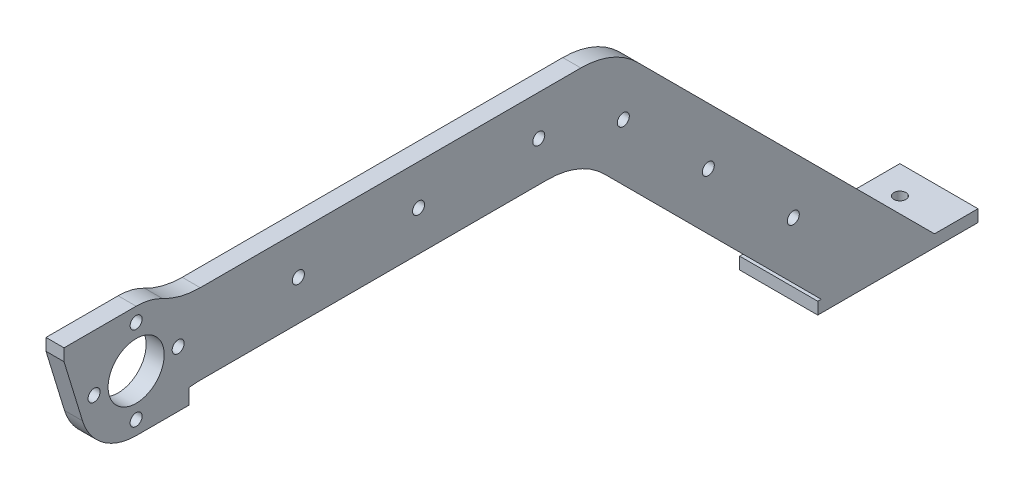
from build123d import *

# Parameters (mm, degrees)
SKETCH_1_R          = 1.5
SKETCH_1_R_2        = 7
EXTRUDE_1_DEPTH     = 2.25
SKETCH_3_W          = 19.5
SKETCH_3_H          = 40
EXTRUDE_2_DEPTH     = 3
SKETCH_4_R          = 1.5
CUT_EXTRUDE_1_DEPTH = 227.967348396


with BuildPart() as part:
    # 草图1 → 凸台-拉伸1 (new, symmetric)
    with BuildSketch(Plane(origin=(0, 0, 0), x_dir=(0, 0, -1), z_dir=(1, 0, 0))):
        with BuildLine():
            ThreePointArc((102.736907967, -10), (110.379173808, -11.526455333), (116.85785315, -15.85785315))
            Line((116.85785315, -15.85785315), (171, -70))
            Line((171, -70), (199.284271247, -70))
            Line((199.284271247, -70), (125.142135624, 4.142135624))
            ThreePointArc((125.142135624, 4.142135624), (118.653668647, 8.47759065), (111, 10))
            Line((111, 10), (16, 10))
            ThreePointArc((16, 10), (11.149287499, 10.597149997), (6.588235294, 12.352941176))
            ThreePointArc((6.588235294, 12.352941176), (3.395498751, 13.581995002), (0, 14))
            Line((0, 14), (-18, 14))
            Line((-18, 14), (-18, 11))
            Line((-18, 11), (-13.388941598, -4.090995342))
            ThreePointArc((-13.388941598, -4.090995342), (-8.328447191, -11.253309175), (0, -14))
            Line((0, -14), (13.224243357, -14))
            Line((13.224243357, -14), (13.224243357, -10.193557234))
            ThreePointArc((13.224243357, -10.193557234), (14.608751519, -10.048447989), (16, -10))
            Line((16, -10), (102.736907967, -10))
        make_face()
        with Locations((164.036406871, -48.894271247)):
            Circle(SKETCH_1_R, mode=Mode.SUBTRACT)
        with Locations((142.823203436, -27.681067812)):
            Circle(SKETCH_1_R, mode=Mode.SUBTRACT)
        with Locations((0, -10.5)):
            Circle(SKETCH_1_R, mode=Mode.SUBTRACT)
        with Locations((-10.5, 0)):
            Circle(SKETCH_1_R, mode=Mode.SUBTRACT)
        Circle(SKETCH_1_R_2, mode=Mode.SUBTRACT)
        with Locations((10.5, 0)):
            Circle(SKETCH_1_R, mode=Mode.SUBTRACT)
        with Locations((0, 10.5)):
            Circle(SKETCH_1_R, mode=Mode.SUBTRACT)
        with Locations((40.5, 0)):
            Circle(SKETCH_1_R, mode=Mode.SUBTRACT)
        with Locations((70.5, 0)):
            Circle(SKETCH_1_R, mode=Mode.SUBTRACT)
        with Locations((121.61, -6.467864376)):
            Circle(SKETCH_1_R, mode=Mode.SUBTRACT)
        with Locations((100.5, 0)):
            Circle(SKETCH_1_R, mode=Mode.SUBTRACT)
    extrude(amount=EXTRUDE_1_DEPTH, both=True)

    # 草图3 → 凸台-拉伸2 (add)
    with BuildSketch(Plane.XZ.offset(70)):
        with Locations((-7.5, -190.144271247)):
            Rectangle(SKETCH_3_W, SKETCH_3_H)
    extrude(amount=EXTRUDE_2_DEPTH)

    # 草图4 → 切除-拉伸1 (cut, through all)
    with BuildSketch(Plane(origin=(0, -70, 0), x_dir=(1, 0, 0), z_dir=(0, 1, 0))):
        with Locations(Location((-10.25, 203.144271247, 0), (0, 0, 270))):
            Circle(SKETCH_4_R)
        with Locations(Location((-10.25, 177.144271247, 0), (0, 0, 90))):
            Circle(SKETCH_4_R)
    extrude(amount=-CUT_EXTRUDE_1_DEPTH, mode=Mode.SUBTRACT)


solid = part.part
